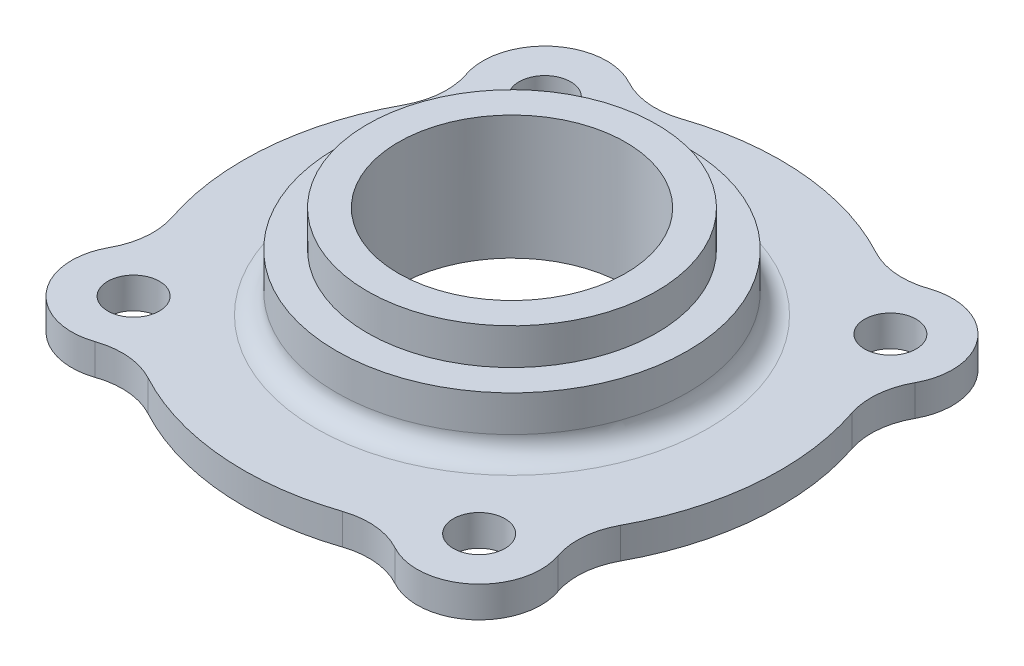
from build123d import *

# Parameters (mm, degrees)
BOSS_EXTRUDE1_DEPTH = 3
SKETCH2_R           = 17
BOSS_EXTRUDE2_DEPTH = 5.5
SKETCH5_R           = 14
BOSS_EXTRUDE3_DEPTH = 3.5
SKETCH6_R           = 11
CUT_EXTRUDE1_DEPTH  = 44.5
SKETCH7_R           = 2.5
CUT_EXTRUDE2_DEPTH  = 44.5
SKETCH8_R           = 2.5
CUT_EXTRUDE3_DEPTH  = 44.5
SKETCH9_R           = 2.5
CUT_EXTRUDE4_DEPTH  = 44.5
SKETCH10_R          = 2.5
CUT_EXTRUDE5_DEPTH  = 44.5
FILLET23_R          = 2


with BuildPart() as part:
    # Sketch1 → Boss-Extrude1 (new body)
    with BuildSketch(Plane(origin=(0, 0, 0), x_dir=(1, 0, 0), z_dir=(0, 1, 0))):
        with BuildLine():
            ThreePointArc((-12.368882592, -22.86942814), (-2.248386141, -25.902601409), (8.243375366, -24.65860423))
            ThreePointArc((8.243375366, -24.65860423), (11.092172188, -24.325815059), (13.835297391, -25.163464204))
            ThreePointArc((13.835297391, -25.163464204), (20.585915101, -24.499389777), (22.403221797, -17.964159812))
            ThreePointArc((22.403221797, -17.964159812), (22.050754674, -15.117730664), (22.86942814, -12.368882592))
            ThreePointArc((22.86942814, -12.368882592), (25.902601409, -2.248386141), (24.65860423, 8.243375366))
            ThreePointArc((24.65860423, 8.243375366), (24.325815059, 11.092172188), (25.163464204, 13.835297391))
            ThreePointArc((25.163464204, 13.835297391), (24.499389777, 20.585915101), (17.964159812, 22.403221797))
            ThreePointArc((17.964159812, 22.403221797), (15.117730664, 22.050754674), (12.368882592, 22.86942814))
            ThreePointArc((12.368882592, 22.86942814), (2.248386141, 25.902601409), (-8.243375366, 24.65860423))
            ThreePointArc((-8.243375366, 24.65860423), (-11.092172188, 24.325815059), (-13.835297391, 25.163464204))
            ThreePointArc((-13.835297391, 25.163464204), (-20.585915101, 24.499389777), (-22.403221797, 17.964159812))
            ThreePointArc((-22.403221797, 17.964159812), (-22.050754674, 15.117730664), (-22.86942814, 12.368882592))
            ThreePointArc((-22.86942814, 12.368882592), (-25.902601409, 2.248386141), (-24.65860423, -8.243375366))
            ThreePointArc((-24.65860423, -8.243375366), (-24.325815059, -11.092172188), (-25.163464204, -13.835297391))
            ThreePointArc((-25.163464204, -13.835297391), (-24.499389777, -20.585915101), (-17.964159812, -22.403221797))
            ThreePointArc((-17.964159812, -22.403221797), (-15.117730664, -22.050754674), (-12.368882592, -22.86942814))
        make_face()
    extrude(amount=-BOSS_EXTRUDE1_DEPTH)

    # Sketch2 → Boss-Extrude2 (add)
    with BuildSketch(Plane(origin=(0, 0, 0), x_dir=(1, 0, 0), z_dir=(0, 1, 0))):
        with Locations(Location((0, 0, 0), (0, 0, 270))):
            Circle(SKETCH2_R)
    extrude(amount=BOSS_EXTRUDE2_DEPTH)

    # Sketch5 → Boss-Extrude3 (add)
    with BuildSketch(Plane(origin=(0, 5.5, 0), x_dir=(1, 0, 0), z_dir=(0, 1, 0))):
        with Locations(Location((0, 0, 0), (0, 0, 270))):
            Circle(SKETCH5_R)
    extrude(amount=BOSS_EXTRUDE3_DEPTH)

    # Sketch6 → Cut-Extrude1 (cut)
    with BuildSketch(Plane(origin=(0, 9, 0), x_dir=(1, 0, 0), z_dir=(0, 1, 0))):
        with Locations(Location((0, 0, 0), (0, 0, 270))):
            Circle(SKETCH6_R)
    extrude(amount=-CUT_EXTRUDE1_DEPTH, mode=Mode.SUBTRACT)

    # Sketch7 → Cut-Extrude2 (cut)
    with BuildSketch(Plane(origin=(0, 0, 0), x_dir=(1, 0, 0), z_dir=(0, 1, 0))):
        with Locations(Location((-16.72605602, 19.905754194, 0), (0, 0, 270))):
            Circle(SKETCH7_R)
    extrude(amount=-CUT_EXTRUDE2_DEPTH, mode=Mode.SUBTRACT)

    # Sketch8 → Cut-Extrude3 (cut)
    with BuildSketch(Plane(origin=(0, 0, 0), x_dir=(1, 0, 0), z_dir=(0, 1, 0))):
        with Locations(Location((16.72605602, -19.905754194, 0), (0, 0, 270))):
            Circle(SKETCH8_R)
    extrude(amount=-CUT_EXTRUDE3_DEPTH, mode=Mode.SUBTRACT)

    # Sketch9 → Cut-Extrude4 (cut)
    with BuildSketch(Plane(origin=(0, 0, 0), x_dir=(1, 0, 0), z_dir=(0, 1, 0))):
        with Locations(Location((-19.905754194, -16.72605602, 0), (0, 0, 270))):
            Circle(SKETCH9_R)
    extrude(amount=-CUT_EXTRUDE4_DEPTH, mode=Mode.SUBTRACT)

    # Sketch10 → Cut-Extrude5 (cut)
    with BuildSketch(Plane(origin=(0, 0, 0), x_dir=(1, 0, 0), z_dir=(0, 1, 0))):
        with Locations(Location((19.905754194, 16.72605602, 0), (0, 0, 270))):
            Circle(SKETCH10_R)
    extrude(amount=-CUT_EXTRUDE5_DEPTH, mode=Mode.SUBTRACT)

    # Fillet23
    fillet23_edges = [part.edges().sort_by_distance(p)[0] for p in [
        (0, 0, -17),
    ]]
    fillet(fillet23_edges, radius=FILLET23_R)


solid = part.part
